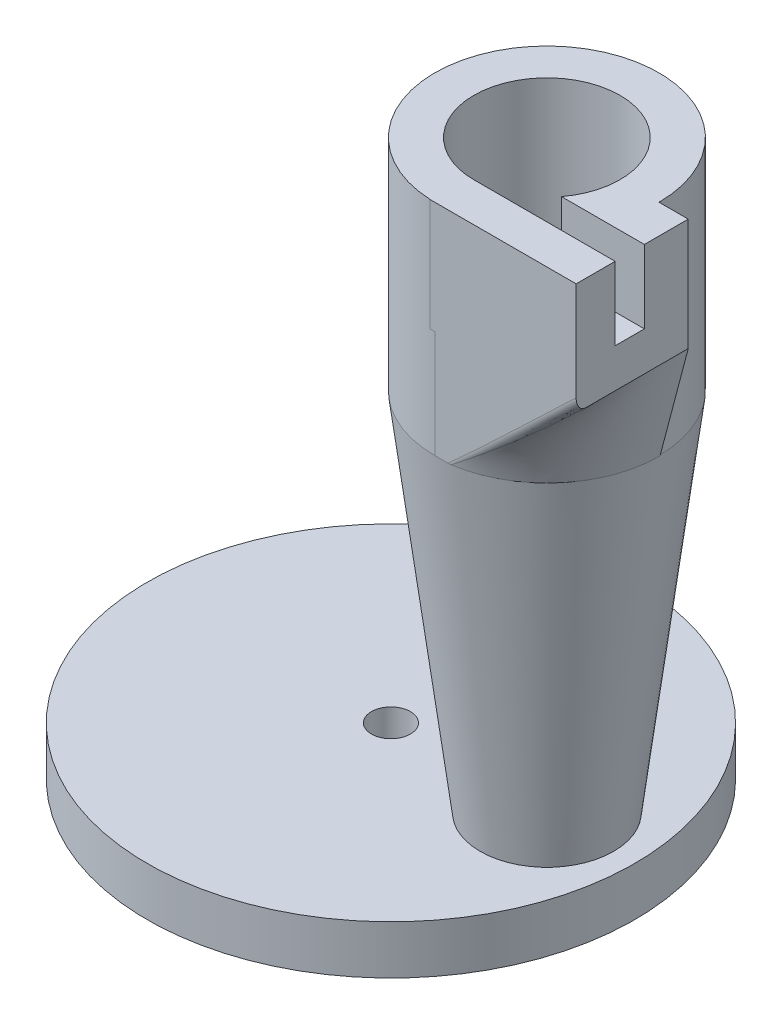
from build123d import *

# Parameters (mm, degrees)
BOSS_EXTRUDE2_DEPTH = 15
SKETCH9_W           = 3
SKETCH9_H           = 7.5
CUT_EXTRUDE2_DEPTH  = 14.5
SKETCH10_R          = 7.5
CUT_EXTRUDE3_DEPTH  = 19
FILLET2_R           = 1
BOSS_EXTRUDE3_START = -5
SKETCH13_R          = 25
SKETCH13_R_2        = 2.815
SKETCH13_R_3        = 2
BOSS_EXTRUDE3_DEPTH = 5


with BuildPart() as part:
    # Sketch1 → Revolve1 (revolve)
    with BuildSketch(Plane.XY, mode=Mode.PRIVATE) as revolve1_sk:
        Polygon((2.815, 0), (7.5, 37.747281127), (7.5, 60), (11.5, 60), (11.5, 37.5), (6.845691272, 0), (8, 0), (8, -5), (2.815, -4.99976246), align=None)
    revolve(revolve1_sk.sketch.rotate(Axis((0, 0, 0), (0, 1, 0)), 90), axis=Axis((0, 0, 0), (0, 1, 0)))

    # Sketch8 → Boss-Extrude2 (add)
    with BuildSketch(Plane(origin=(14.5, 0, 0), x_dir=(0, 0, -1), z_dir=(1, 0, 0))):
        Polygon((-7.5, 60), (-11.5, 60), (-11.5, 48.5), (0, 48.5), (0, 60), (-4.5, 60), (-4.5, 52.5), (-7.5, 52.5), align=None)
    extrude(amount=-BOSS_EXTRUDE2_DEPTH)

    # Sketch9 → Cut-Extrude2 (cut)
    with BuildSketch(Plane(origin=(14.5, 0, 0), x_dir=(0, 0, -1), z_dir=(1, 0, 0))):
        with Locations((-6, 56.25)):
            Rectangle(SKETCH9_W, SKETCH9_H)
    extrude(amount=-CUT_EXTRUDE2_DEPTH, mode=Mode.SUBTRACT)

    # Sketch10 → Cut-Extrude3 (cut)
    with BuildSketch(Plane(origin=(0, 60, 0), x_dir=(1, 0, 0), z_dir=(0, 1, 0))):
        with Locations(Location((0, 0, 0), (0, 0, 90))):
            Circle(SKETCH10_R)
    extrude(amount=-CUT_EXTRUDE3_DEPTH, mode=Mode.SUBTRACT)

    # Sketch11 for Loft4 → Loft4 section 0
    with BuildSketch(Plane.XZ.offset(-48.5)):
        with BuildLine():
            Line((0, 11.5), (14.5, 11.5))
            Line((14.5, 11.5), (14.5, 0))
            Line((14.5, 0), (11.5, 0))
            # circular arc as an exact rational Bezier (weights 1, cos(half-angle), 1)
            Bezier((11.5, 0), (11.5, 11.5), (0, 11.5), weights=[1, 0.707106781, 1])
        make_face()
    # Sketch12 for Loft4 → Loft4 section 1
    with BuildSketch(Plane(origin=(0, 37.5, 0), x_dir=(1, 0, 0), z_dir=(0, 1, 0))):
        with BuildLine():
            Line((0, -11.5), (1.519868415, -11.5))
            Bezier((1.519868415, -11.5), (11.6, -10.167784903), (11.6, 0), weights=[1, 0.752005033, 1])
            Line((11.6, 0), (11.5, 0))
            Bezier((11.5, 0), (11.5, -11.5), (0, -11.5), weights=[1, 0.707106781, 1])
        make_face()
    loft()

    # Fillet2
    fillet2_edges = [part.edges().sort_by_distance(p)[0] for p in [
        (8.009934208, 43, 11.5),
    ]]
    fillet(fillet2_edges, radius=FILLET2_R)

    # Sketch13 → Boss-Extrude3 (add)
    with BuildSketch(Plane.XZ.offset(5).offset(BOSS_EXTRUDE3_START)):
        with Locations(Location((-16, 0, 0), (0, 0, 270))):
            Circle(SKETCH13_R)
        with Locations(Location((0, 0, 0), (0, 0, 270))):
            Circle(SKETCH13_R_2, mode=Mode.SUBTRACT)
        with Locations(Location((-16, 0, 0), (0, 0, 270))):
            Circle(SKETCH13_R_3, mode=Mode.SUBTRACT)
    extrude(amount=BOSS_EXTRUDE3_DEPTH)


solid = part.part
